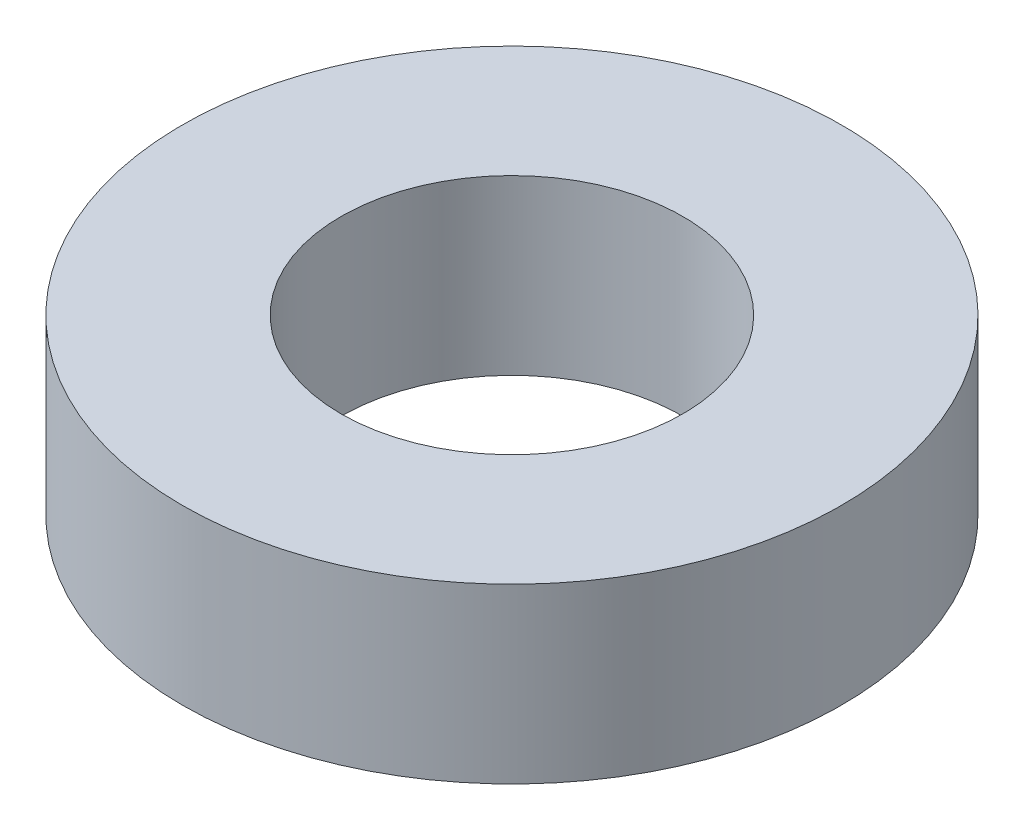
from build123d import *

# Parameters (mm, degrees)
SKETCH1_R           = 8
SKETCH1_R_2         = 4.15
BOSS_EXTRUDE1_DEPTH = 4.2


with BuildPart() as part:
    # Sketch1 → Boss-Extrude1 (new body)
    with BuildSketch(Plane(origin=(0, 0, 0), x_dir=(1, 0, 0), z_dir=(0, 1, 0))):
        with Locations(Location((0, 0, 0), (0, 0, 270))):
            Circle(SKETCH1_R)
        with Locations(Location((0, 0, 0), (0, 0, 270))):
            Circle(SKETCH1_R_2, mode=Mode.SUBTRACT)
    extrude(amount=BOSS_EXTRUDE1_DEPTH)


solid = part.part
